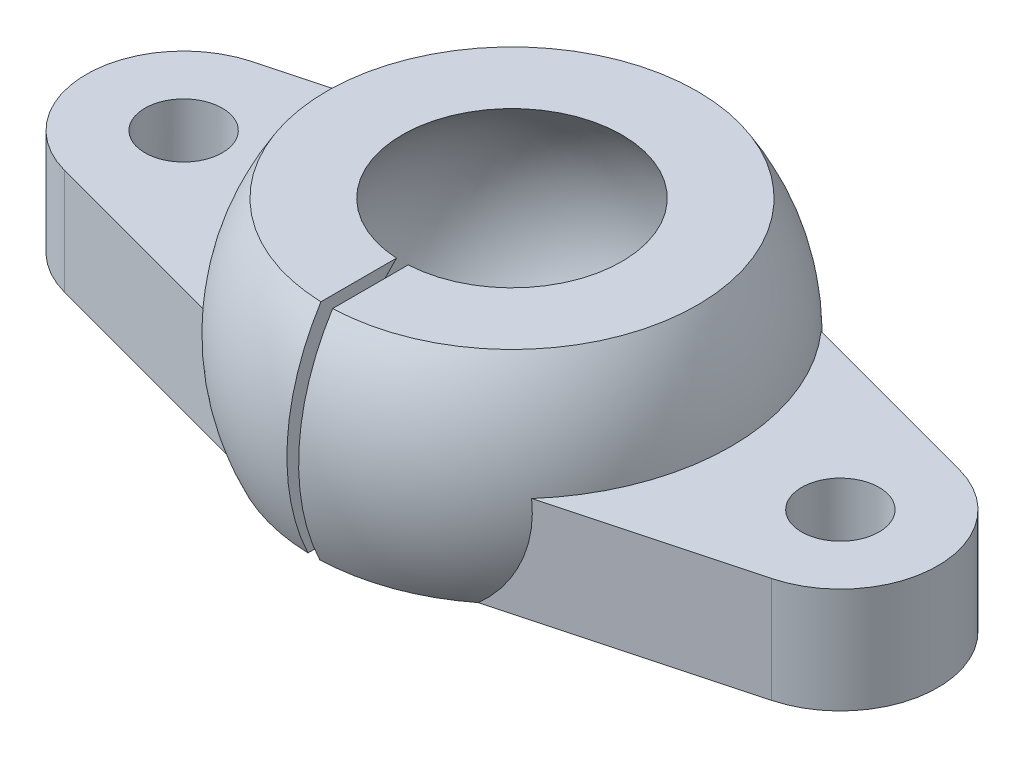
from build123d import *

# Parameters (mm, degrees)
ESQUISSE3_R                          = 1.65
BOSS_EXTRU_1_DEPTH                   = 4.5
CHANFREIN1_SIZE                      = 1.5
ENL_V_DE_MAT_EXTRU_MINCE1_DEPTH      = 23.312440476
ENL_V_DE_MAT_EXTRU_MINCE1_DEPTH_BACK = 23.312440476
ESQUISSE4_W                          = 0.5
ESQUISSE4_H                          = 9.35


with BuildPart() as part:
    # Esquisse1 → Révolution1 (revolve)
    with BuildSketch(Plane.XY):
        with BuildLine():
            Line((-5.85, -3.563705936), (-6.566198339, -4))
            Line((-6.566198339, -4), (-8.451183349, -4))
            ThreePointArc((-8.451183349, -4), (-9.332564872, 0.570730153), (-7.9007911, 5))
            Line((-7.9007911, 5), (-4.682146943, 5))
            ThreePointArc((-4.682146943, 5), (-6.787178696, 0.925583789), (-5.85, -3.563705936))
        make_face()
    revolve(axis=Axis((0, 11.493598295, 0), (0, -1, 0)))

    # Esquisse3 → Boss.-Extru.1 (add)
    # profile 1 of 2: a face of its own
    with BuildSketch(Plane.XZ.offset(4)):
        with BuildLine():
            Line((-15.074099037, 4.008592179), (-3.376482998, 7.14295895))
            ThreePointArc((-3.376482998, 7.14295895), (-7.9007911, 0), (-3.376482998, -7.14295895))
            Line((-3.376482998, -7.14295895), (-15.074099037, -4.008592179))
            ThreePointArc((-15.074099037, -4.008592179), (-18.15, 0), (-15.074099037, 4.008592179))
        make_face()
        with Locations((-14, 0)):
            Circle(ESQUISSE3_R, mode=Mode.SUBTRACT)
    # profile 2 of 2: a face of its own
    with BuildSketch(Plane.XZ.offset(4)):
        with BuildLine():
            Line((15.074099037, 4.008592179), (3.376482998, 7.14295895))
            ThreePointArc((3.376482998, 7.14295895), (7.9007911, 0), (3.376482998, -7.14295895))
            Line((3.376482998, -7.14295895), (15.074099037, -4.008592179))
            ThreePointArc((15.074099037, -4.008592179), (18.15, 0), (15.074099037, 4.008592179))
        make_face()
        with Locations((14, 0)):
            Circle(ESQUISSE3_R, mode=Mode.SUBTRACT)
    extrude(amount=-BOSS_EXTRU_1_DEPTH)

    # Chanfrein1
    chanfrein1_edges = [part.edges().sort_by_distance(p)[0] for p in [
        (12.35, -4, 0),
        (-15.65, -4, 0),
    ]]
    chamfer(chanfrein1_edges, length=CHANFREIN1_SIZE)

    # Esquisse4 → Enlèv. de mat.-Extru.-Mince1 (cut, two sides: drawn at the far end of the back side and taken through both)
    with BuildSketch(Plane(origin=(0, 5, 0), x_dir=(1, 0, 0), z_dir=(0, 1, 0)).offset(-ENL_V_DE_MAT_EXTRU_MINCE1_DEPTH_BACK)):
        with Locations((0, -4.675)):
            Rectangle(ESQUISSE4_W, ESQUISSE4_H)
    extrude(amount=ENL_V_DE_MAT_EXTRU_MINCE1_DEPTH + ENL_V_DE_MAT_EXTRU_MINCE1_DEPTH_BACK, mode=Mode.SUBTRACT)


solid = part.part
